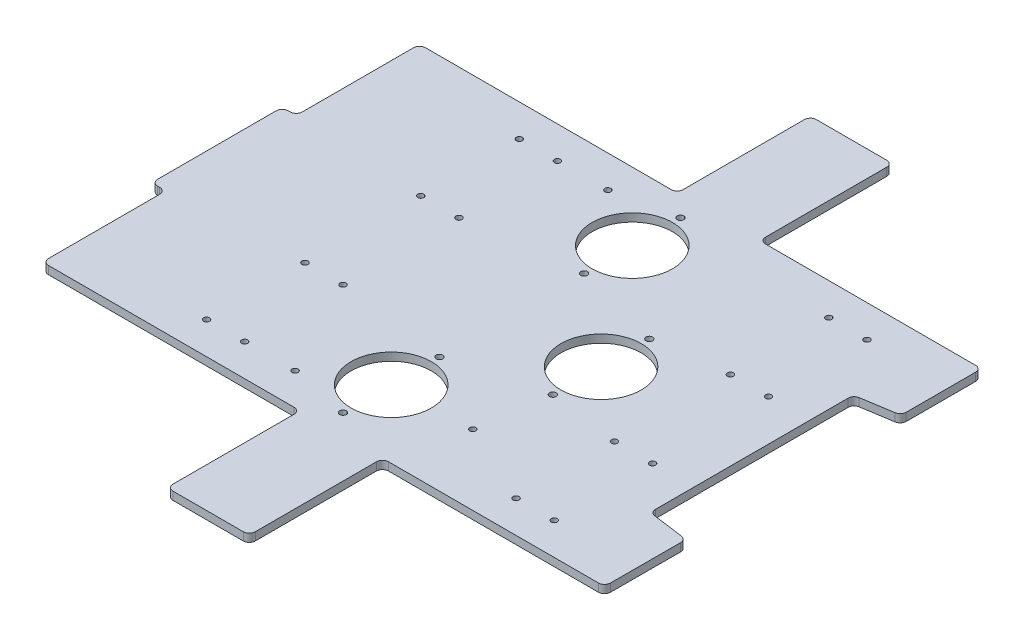
from build123d import *

# Parameters (mm, degrees)
SKETCH1_R           = 20
SKETCH1_R_2         = 1.5
SKETCH1_R_3         = 1.65
BOSS_EXTRUDE2_DEPTH = 4
FILLET1_R           = 3


with BuildPart() as part:
    # Sketch1 → Boss-Extrude2 (new body)
    with BuildSketch(Plane(origin=(0, 0, 0), x_dir=(1, 0, 0), z_dir=(0, 1, 0))):
        Polygon((92.45867298, 93.85), (92.45867298, 53.803836873), (71.914755495, 50.55), (71.914755495, -50.55), (92.528223413, -53.3293777), (92.45867298, -93.85), (-18.04132702, -93.85), (-18.04132702, -160.15), (-59.04132702, -160.15), (-59.04132702, -93.85), (-187.29132702, -93.85), (-187.29132702, -32.5), (-194.29132702, -32.5), (-194.29132702, 32.5), (-187.29132702, 32.5), (-187.29132702, 34.274594508), (-187.29132702, 93.85), (-59.04132702, 93.85), (-59.04132702, 160.15), (-18.04132702, 160.15), (-18.04132702, 93.85), align=None)
        with Locations(Location((-47.54132702, 60, 0), (0, 0, 270))):
            Circle(SKETCH1_R, mode=Mode.SUBTRACT)
        with Locations(Location((-3.085244505, 0, 0), (0, 0, 270))):
            Circle(SKETCH1_R, mode=Mode.SUBTRACT)
        with Locations(Location((-47.54132702, -60, 0), (0, 0, 90))):
            Circle(SKETCH1_R, mode=Mode.SUBTRACT)
        with Locations(Location((-77.54132702, 77.85, 0), (0, 0, 270))):
            Circle(SKETCH1_R_2, mode=Mode.SUBTRACT)
        with Locations(Location((-121.62132702, 28.85, 0), (0, 0, 270))):
            Circle(SKETCH1_R_2, mode=Mode.SUBTRACT)
        with Locations(Location((-102.65132702, 28.85, 0), (0, 0, 270))):
            Circle(SKETCH1_R_2, mode=Mode.SUBTRACT)
        with Locations(Location((-121.62132702, -28.85, 0), (0, 0, 90))):
            Circle(SKETCH1_R_2, mode=Mode.SUBTRACT)
        with Locations(Location((-102.65132702, -28.85, 0), (0, 0, 90))):
            Circle(SKETCH1_R_2, mode=Mode.SUBTRACT)
        with Locations(Location((-77.54132702, -77.85, 0), (0, 0, 90))):
            Circle(SKETCH1_R_2, mode=Mode.SUBTRACT)
        with Locations(Location((32.45867298, 77.85, 0), (0, 0, 270))):
            Circle(SKETCH1_R_2, mode=Mode.SUBTRACT)
        with Locations(Location((-8.085244505, -58.85, 0), (0, 0, 270))):
            Circle(SKETCH1_R_2, mode=Mode.SUBTRACT)
        with Locations(Location((32.45867298, -77.85, 0), (0, 0, 90))):
            Circle(SKETCH1_R_2, mode=Mode.SUBTRACT)
        with Locations(Location((-121.62132702, -77.85, 0), (0, 0, 90))):
            Circle(SKETCH1_R_2, mode=Mode.SUBTRACT)
        with Locations(Location((-102.65132702, -77.85, 0), (0, 0, 90))):
            Circle(SKETCH1_R_2, mode=Mode.SUBTRACT)
        with Locations(Location((51.42867298, -77.85, 0), (0, 0, 90))):
            Circle(SKETCH1_R_2, mode=Mode.SUBTRACT)
        with Locations(Location((32.444755495, -28.85, 0), (0, 0, 90))):
            Circle(SKETCH1_R_2, mode=Mode.SUBTRACT)
        with Locations(Location((51.414755495, -28.85, 0), (0, 0, 90))):
            Circle(SKETCH1_R_2, mode=Mode.SUBTRACT)
        with Locations(Location((-121.62132702, 77.85, 0), (0, 0, 270))):
            Circle(SKETCH1_R_2, mode=Mode.SUBTRACT)
        with Locations(Location((-102.65132702, 77.85, 0), (0, 0, 270))):
            Circle(SKETCH1_R_2, mode=Mode.SUBTRACT)
        with Locations(Location((51.414755495, 28.85, 0), (0, 0, 270))):
            Circle(SKETCH1_R_2, mode=Mode.SUBTRACT)
        with Locations(Location((32.444755495, 28.85, 0), (0, 0, 270))):
            Circle(SKETCH1_R_2, mode=Mode.SUBTRACT)
        with Locations(Location((51.42867298, 77.85, 0), (0, 0, 270))):
            Circle(SKETCH1_R_2, mode=Mode.SUBTRACT)
        with Locations(Location((-47.54132702, -84, 0), (0, 0, 270))):
            Circle(SKETCH1_R_3, mode=Mode.SUBTRACT)
        with Locations(Location((-47.54132702, -36, 0), (0, 0, 270))):
            Circle(SKETCH1_R_3, mode=Mode.SUBTRACT)
        with Locations(Location((-3.085244505, -24, 0), (0, 0, 270))):
            Circle(SKETCH1_R_3, mode=Mode.SUBTRACT)
        with Locations(Location((-3.085244505, 24, 0), (0, 0, 270))):
            Circle(SKETCH1_R_3, mode=Mode.SUBTRACT)
        with Locations(Location((-47.54132702, 36, 0), (0, 0, 270))):
            Circle(SKETCH1_R_3, mode=Mode.SUBTRACT)
        with Locations(Location((-47.54132702, 84, 0), (0, 0, 270))):
            Circle(SKETCH1_R_3, mode=Mode.SUBTRACT)
    extrude(amount=BOSS_EXTRUDE2_DEPTH)

    # Fillet1
    fillet1_edges = [part.edges().sort_by_distance(p)[0] for p in [
        (-187.29132702, 2, -93.85),
        (-59.04132702, 2, -93.85),
        (-59.04132702, 2, -160.15),
        (-18.04132702, 2, -160.15),
        (-18.04132702, 2, -93.85),
        (92.45867298, 2, -93.85),
        (92.45867298, 2, -53.803836873),
        (71.914755495, 2, -50.55),
        (71.914755495, 2, 50.55),
        (92.528223413, 2, 53.3293777),
        (92.45867298, 2, 93.85),
        (-18.04132702, 2, 93.85),
        (-18.04132702, 2, 160.15),
        (-59.04132702, 2, 160.15),
        (-59.04132702, 2, 93.85),
        (-187.29132702, 2, 93.85),
        (-187.29132702, 2, 32.5),
        (-194.29132702, 2, 32.5),
        (-194.29132702, 2, -32.5),
        (-187.29132702, 2, -32.5),
    ]]
    fillet(fillet1_edges, radius=FILLET1_R)


solid = part.part
